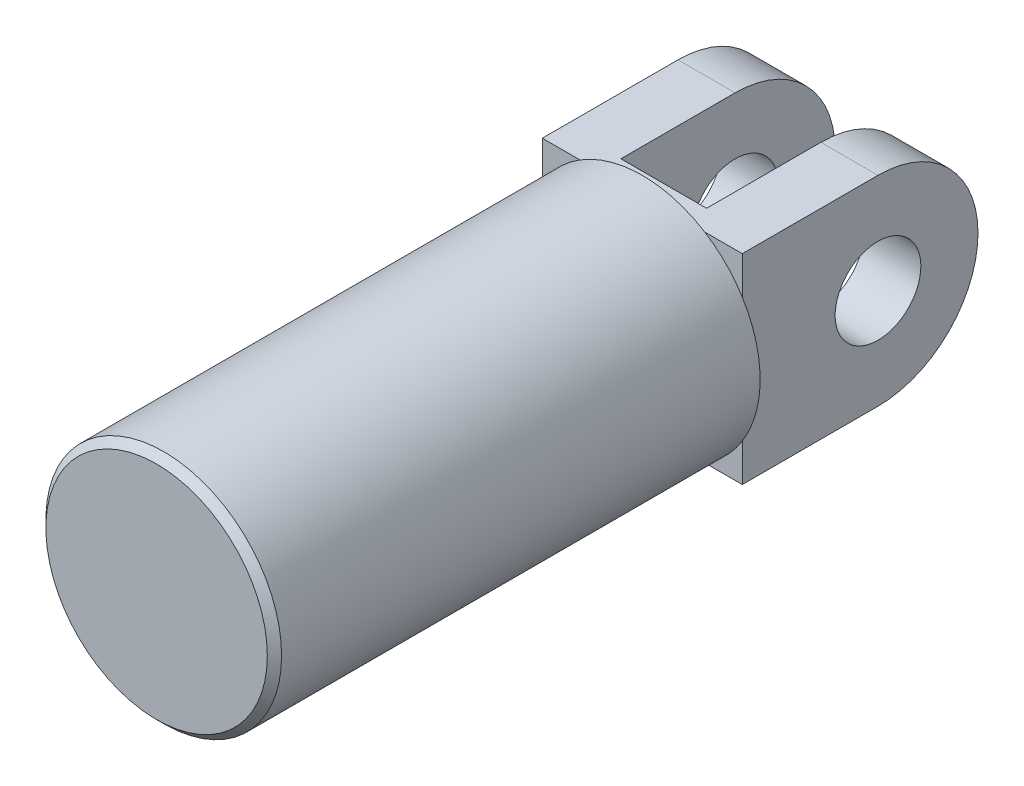
from build123d import *

# Parameters (mm, degrees)
SKETCH_1_R          = 16.5
EXTRUDE_1_DEPTH     = 68
CHAMFER_1_SIZE      = 1
SKETCH_3_R          = 6
EXTRUDE_2_DEPTH     = 14
CUT_EXTRUDE_3_DEPTH = 6


with BuildPart() as part:
    # 草圖1 → 伸長1 (new body)
    with BuildSketch(Plane.XY):
        Circle(SKETCH_1_R)
    extrude(amount=EXTRUDE_1_DEPTH)

    # 導角1
    chamfer_1_edges = [part.edges().sort_by_distance(p)[0] for p in [
        (-16.5, 0, 68),
    ]]
    chamfer(chamfer_1_edges, length=CHAMFER_1_SIZE)

    # 草圖3 → 伸長2 (add, symmetric)
    with BuildSketch(Plane(origin=(0, 0, 0), x_dir=(0, 0, -1), z_dir=(1, 0, 0))):
        with BuildLine():
            Line((0, 14), (19, 14))
            ThreePointArc((19, 14), (33, 0), (19, -14))
            Line((19, -14), (0, -14))
            Line((0, -14), (0, 14))
        make_face()
        with Locations((19, 0)):
            Circle(SKETCH_3_R, mode=Mode.SUBTRACT)
    extrude(amount=EXTRUDE_2_DEPTH, both=True)

    # 草圖4 → 伸長3 (cut, symmetric)
    with BuildSketch(Plane(origin=(0, 0, 0), x_dir=(0, 0, -1), z_dir=(1, 0, 0))):
        with BuildLine():
            Line((3, 14), (3, -14))
            Line((3, -14), (19, -14))
            ThreePointArc((19, -14), (33, 0), (19, 14))
            Line((19, 14), (3, 14))
        make_face()
    extrude(amount=CUT_EXTRUDE_3_DEPTH, both=True, mode=Mode.SUBTRACT)


solid = part.part
